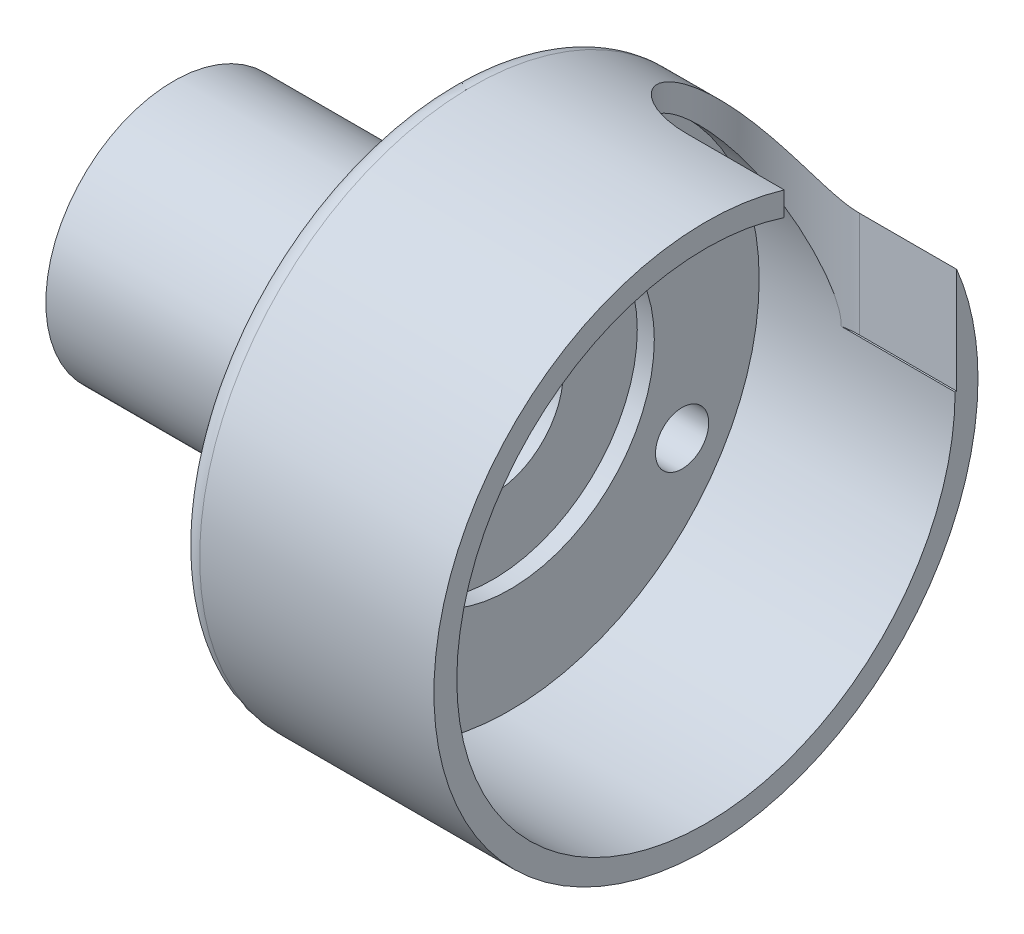
from build123d import *

# Parameters (mm, degrees)
BOSS_EXTRUDE3_DEPTH      = 10
BOSS_EXTRUDE3_DEPTH_BACK = 5
SKETCH3_R                = 6
SKETCH3_R_2              = 3.3
SKETCH10_R               = 12.775
SKETCH10_R_2             = 3.65
SKETCH10_R_3             = 2.1
BOSS_EXTRUDE5_DEPTH      = 2
SKETCH11_R               = 11.275
SKETCH11_R_2             = 6.775
BOSS_EXTRUDE6_DEPTH      = 0.8
SKETCH12_R               = 1.25
CUT_EXTRUDE2_DEPTH       = 2.75
FILLET3_R                = 1
SKETCH13_R               = 12.775
SKETCH13_R_2             = 11.275
BOSS_EXTRUDE7_DEPTH      = 10
SKETCH14_R               = 11.7
CUT_EXTRUDE3_DEPTH       = 9.2
CUT_EXTRUDE5_DEPTH       = 16
SKETCH16_R               = 4.5
CUT_EXTRUDE6_DEPTH       = 14


with BuildPart() as part:
    # Sketch3 → Boss-Extrude3 (new, two sides: drawn at the far end of the back side and taken through both)
    with BuildSketch(Plane(origin=(0, 0, 0), x_dir=(0, 0, -1), z_dir=(1, 0, 0)).offset(-BOSS_EXTRUDE3_DEPTH_BACK)):
        Circle(SKETCH3_R)
        Circle(SKETCH3_R_2, mode=Mode.SUBTRACT)
    extrude(amount=BOSS_EXTRUDE3_DEPTH + BOSS_EXTRUDE3_DEPTH_BACK)

    # Sketch10 → Boss-Extrude5 (add)
    # profile 1 of 2: a face of its own
    with BuildSketch(Plane(origin=(10, 0, 0), x_dir=(0, 0, -1), z_dir=(1, 0, 0))):
        Circle(SKETCH10_R)
        Circle(SKETCH10_R_2, mode=Mode.SUBTRACT)
    # profile 2 of 2: a face of its own
    with BuildSketch(Plane(origin=(10, 0, 0), x_dir=(0, 0, -1), z_dir=(1, 0, 0))):
        Circle(SKETCH10_R_3)
    extrude(amount=-BOSS_EXTRUDE5_DEPTH)


with BuildPart() as boss_extrude5_kept_piece:
    # of the separate pieces the step leaves, the one the design keeps (boss_extrude5_pieces_kept)
    add(part.part.solids().sort_by_distance((0, 0, -6))[0])

    # Sketch11 → Boss-Extrude6 (add)
    with BuildSketch(Plane(origin=(10, 0, 0), x_dir=(0, 0, -1), z_dir=(1, 0, 0))):
        Circle(SKETCH11_R)
        Circle(SKETCH11_R_2, mode=Mode.SUBTRACT)
    extrude(amount=BOSS_EXTRUDE6_DEPTH)

    # Sketch12 → Cut-Extrude2 (cut)
    with BuildSketch(Plane(origin=(10.8, 0, 0), x_dir=(0, 0, -1), z_dir=(1, 0, 0))):
        with BuildLine():
            ThreePointArc((9.330017017, -4.665), (8.705017017, -3.582468245), (7.455017017, -3.582468245))
            Line((7.455017017, -3.582468245), (8.080017017, -4.665))
            Line((8.080017017, -4.665), (6.830017017, -4.665))
            ThreePointArc((6.830017017, -4.665), (8.080017017, -5.915), (9.330017017, -4.665))
        make_face()
        with BuildLine():
            Line((8.080017017, -4.665), (7.455017017, -3.582468245))
            ThreePointArc((7.455017017, -3.582468245), (6.997485263, -4.04), (6.830017017, -4.665))
            Line((6.830017017, -4.665), (8.080017017, -4.665))
        make_face()
        with BuildLine():
            Line((0.625, 8.247468245), (0, 9.33))
            Line((0, 9.33), (-0.625, 8.247468245))
            ThreePointArc((-0.625, 8.247468245), (0, 8.08), (0.625, 8.247468245))
        make_face()
        with BuildLine():
            Line((-0.625, 8.247468245), (0, 9.33))
            Line((0, 9.33), (0.625, 8.247468245))
            ThreePointArc((0.625, 8.247468245), (1.082531755, 8.705), (1.25, 9.33))
            ThreePointArc((1.25, 9.33), (-0.625, 10.412531755), (-0.625, 8.247468245))
        make_face()
        with Locations((-8.080017017, -4.665)):
            Circle(SKETCH12_R)
    extrude(amount=-CUT_EXTRUDE2_DEPTH, mode=Mode.SUBTRACT)

    # Fillet3
    fillet3_edges = [boss_extrude5_kept_piece.edges().sort_by_distance(p)[0] for p in [
        (8, 0, 12.775),
    ]]
    fillet(fillet3_edges, radius=FILLET3_R)

    # Sketch13 → Boss-Extrude7 (add)
    with BuildSketch(Plane(origin=(10, 0, 0), x_dir=(0, 0, -1), z_dir=(1, 0, 0))):
        Circle(SKETCH13_R)
        Circle(SKETCH13_R_2, mode=Mode.SUBTRACT)
    extrude(amount=BOSS_EXTRUDE7_DEPTH)

    # Sketch14 → Cut-Extrude3 (cut)
    with BuildSketch(Plane(origin=(20, 0, 0), x_dir=(0, 0, -1), z_dir=(1, 0, 0))):
        Circle(SKETCH14_R)
    extrude(amount=-CUT_EXTRUDE3_DEPTH, mode=Mode.SUBTRACT)

    # Sketch15 → Cut-Extrude5 (cut)
    with BuildSketch(Plane(origin=(0, 0, 0), x_dir=(1, 0, 0), z_dir=(0, 1, 0))):
        with BuildLine():
            Line((15.430071931, 3.675), (20, 3.675))
            Line((20, 3.675), (20, 11.775))
            Line((20, 11.775), (15.430071931, 11.775))
            ThreePointArc((15.430071931, 11.775), (11.380071931, 7.725), (15.430071931, 3.675))
        make_face()
    extrude(amount=CUT_EXTRUDE5_DEPTH, mode=Mode.SUBTRACT)

    # Sketch16 → Cut-Extrude6 (cut)
    with BuildSketch(Plane.ZY.offset(5)):
        Circle(SKETCH16_R)
    extrude(amount=-CUT_EXTRUDE6_DEPTH, mode=Mode.SUBTRACT)


solid = boss_extrude5_kept_piece.part
